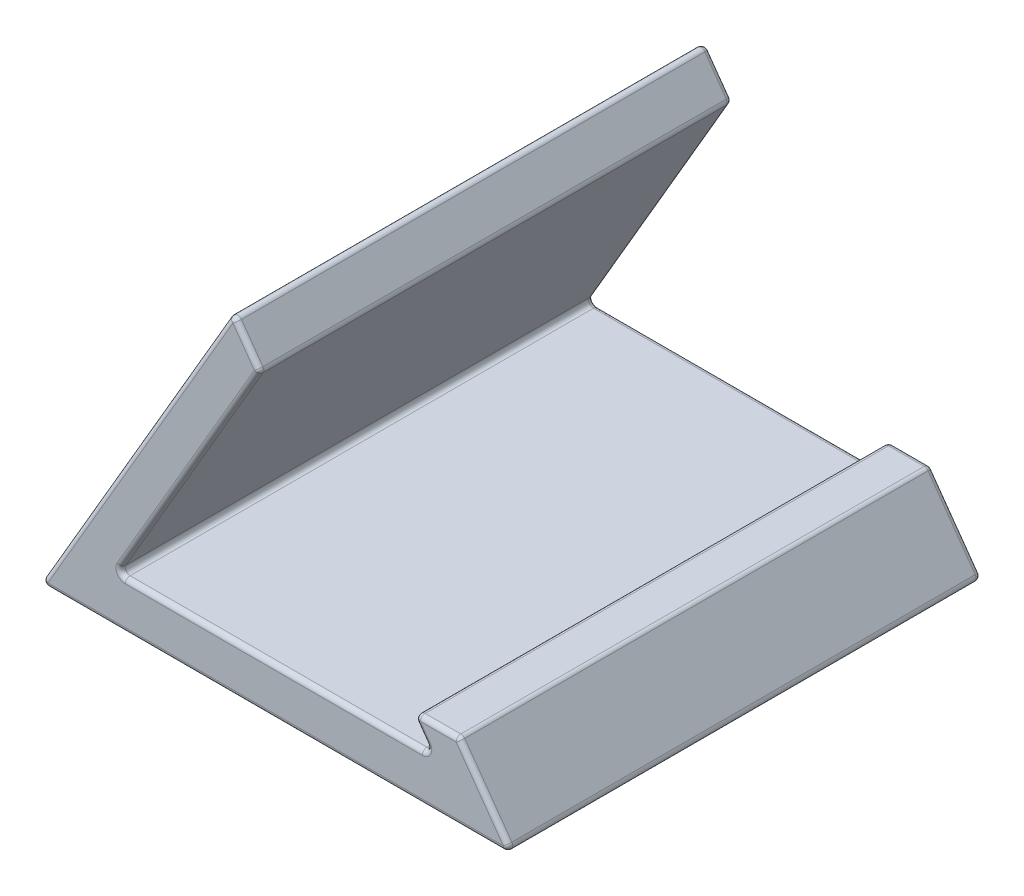
from build123d import *

# Parameters (mm, degrees)
BOSS_EXTRUDE1_DEPTH = 50
FILLET1_R           = 0.5
SKETCH2_W           = 0.897435897
SKETCH2_H           = 5
CUT_EXTRUDE1_DEPTH  = 0.1


with BuildPart() as part:
    # Sketch1 → Boss-Extrude1 (new body)
    with BuildSketch(Plane.XY):
        Polygon((-22.379025494, 0), (27.620974506, 0), (21.919160421, 8), (16.919160421, 8), (19.057340703, 5), (-14.189804496, 5), (0.916580308, 30.919049715), (-1.985406009, 34.990717116), align=None)
    extrude(amount=BOSS_EXTRUDE1_DEPTH)

    # Fillet1
    fillet1_edges = [part.edges().sort_by_distance(p)[0] for p in [
        (2.433768103, 5, 0),
        (17.988250562, 6.5, 0),
        (19.419160421, 8, 0),
        (24.770067463, 4, 0),
        (17.988250562, 6.5, 50),
        (27.620974506, 0, 25),
        (-22.379025494, 0, 25),
        (-1.985406009, 34.990717116, 25),
        (0.916580308, 30.919049715, 25),
        (-14.189804496, 5, 25),
        (19.057340703, 5, 25),
        (16.919160421, 8, 25),
        (21.919160421, 8, 25),
        (2.433768103, 5, 50),
        (-6.636612094, 17.959524858, 50),
        (-0.53441285, 32.954883416, 50),
        (-12.182215751, 17.495358558, 50),
        (2.620974506, 0, 50),
        (24.770067463, 4, 50),
        (2.620974506, 0, 0),
        (19.419160421, 8, 50),
        (-12.182215751, 17.495358558, 0),
        (-0.53441285, 32.954883416, 0),
        (-6.636612094, 17.959524858, 0),
    ]]
    fillet(fillet1_edges, radius=FILLET1_R)

    # Sketch2 → Cut-Extrude1 (cut)
    # profile 1 of 7: a face of its own
    with BuildSketch(Plane(origin=(-16.704628091, 9.73594876, 0), x_dir=(0, 0, 1), z_dir=(-0.8639683238467751, 0.503546160137672, 0))):
        with Locations((10.97078353, 11.529115034)):
            Rectangle(SKETCH2_W, SKETCH2_H)
    # profile 2 of 7: a face of its own
    with BuildSketch(Plane(origin=(-16.704628091, 9.73594876, 0), x_dir=(0, 0, 1), z_dir=(-0.8639683238467751, 0.503546160137672, 0))):
        with BuildLine():
            Line((12.445142504, 12.682961188), (13.342578401, 12.682961188))
            Line((13.342578401, 12.682961188), (13.342578401, 12.296342598))
            add(Edge.make_bspline(
                [(13.342578401, 12.296342598), (13.393776674, 12.33616567), (13.491626527, 12.4122753), (13.640375197, 12.509315467), (13.780775526, 12.588738947), (13.915957185, 12.64915251), (14.048463623, 12.692617471), (14.180440876, 12.723844453), (14.313854353, 12.743839947), (14.403540593, 12.745989727), (14.448347632, 12.747063752)],
                knots=[0, 0, 0, 0, 1.276643801, 2.439914479, 3.493451431, 4.44993799, 5.350072675, 6.235028322, 7.118224225, 8, 8, 8, 8], degree=3))
            add(Edge.make_bspline(
                [(14.448347632, 12.747063752), (14.493798343, 12.745836364), (14.583021906, 12.743426897), (14.714398686, 12.726574632), (14.83991644, 12.69588132), (14.960986513, 12.655128902), (15.076376618, 12.601338047), (15.187500355, 12.537470134), (15.291970823, 12.459674696), (15.356308363, 12.400429425), (15.38885244, 12.370461188)],
                knots=[0, 0, 0, 0, 1.048836932, 2.058954983, 3.049370783, 4.026390553, 5.001981509, 5.982488534, 6.97947532, 8, 8, 8, 8], degree=3))
            add(Edge.make_bspline(
                [(15.38885244, 12.370461188), (15.414953987, 12.342689396), (15.467348114, 12.286942555), (15.533279539, 12.191545433), (15.589856119, 12.087545108), (15.636212764, 11.973741904), (15.670468457, 11.849510545), (15.696821829, 11.716351569), (15.711609166, 11.573519383), (15.713434732, 11.475395019), (15.714373273, 11.424948368)],
                knots=[0, 0, 0, 0, 0.889584746, 1.785680191, 2.700364693, 3.65222533, 4.649950538, 5.707241244, 6.821271309, 8, 8, 8, 8], degree=3))
            Line((15.714373273, 11.424948368), (15.714373273, 9.029115034))
            Line((15.714373273, 9.029115034), (14.816937376, 9.029115034))
            Line((14.816937376, 9.029115034), (14.816937376, 10.615653496))
            add(Edge.make_bspline(
                [(14.816937376, 10.615653496), (14.816747588, 10.667403617), (14.816383895, 10.766573118), (14.813591535, 10.908499578), (14.808139223, 11.036677602), (14.803169583, 11.151340566), (14.793412203, 11.252081339), (14.78461284, 11.339537686), (14.771111071, 11.412916199), (14.753543079, 11.491845799), (14.722865038, 11.576354369), (14.675238876, 11.665398109), (14.61481841, 11.741042752), (14.544071454, 11.803818603), (14.463076141, 11.85348006), (14.372811184, 11.888419988), (14.273760509, 11.910195409), (14.204743162, 11.912522102), (14.168900517, 11.913730419)],
                knots=[0, 0, 0, 0, 1.49886392, 2.872294502, 4.110984203, 5.214877267, 6.195405875, 7.042225351, 7.75923308, 8.355011229, 9.382752534, 10.352059385, 11.267231453, 12.171456522, 13.078624015, 14.003401117, 14.963110155, 16, 16, 16, 16], degree=3))
            add(Edge.make_bspline(
                [(14.168900517, 11.913730419), (14.122285649, 11.911366566), (14.031097905, 11.906742412), (13.899213076, 11.871872065), (13.778079059, 11.81256787), (13.668685616, 11.730502789), (13.572074631, 11.629183278), (13.49250326, 11.508348138), (13.427238389, 11.370913719), (13.399173524, 11.270564269), (13.384645709, 11.218618239)],
                knots=[0, 0, 0, 0, 0.984188326, 1.925263693, 2.85911992, 3.81709677, 4.80007086, 5.801799564, 6.862098548, 8, 8, 8, 8], degree=3))
            add(Edge.make_bspline(
                [(13.384645709, 11.218618239), (13.38103497, 11.202304241), (13.372982295, 11.165920744), (13.366359989, 11.104454802), (13.357147881, 11.031531414), (13.35369633, 10.945830871), (13.347694463, 10.847758758), (13.345474686, 10.737185328), (13.343250937, 10.614327397), (13.342810007, 10.5285158), (13.342578401, 10.483441957)],
                knots=[0, 0, 0, 0, 0.543362196, 1.211806945, 2.009705693, 2.934833164, 4.000995085, 5.207458376, 6.533175157, 8, 8, 8, 8], degree=3))
            Line((13.342578401, 10.483441957), (13.342578401, 9.029115034))
            Line((13.342578401, 9.029115034), (12.445142504, 9.029115034))
            Line((12.445142504, 9.029115034), (12.445142504, 12.682961188))
        make_face()
    # profile 3 of 7: a face of its own
    with BuildSketch(Plane(origin=(-16.704628091, 9.73594876, 0), x_dir=(0, 0, 1), z_dir=(-0.8639683238467751, 0.503546160137672, 0))):
        with BuildLine():
            Line((16.611809171, 12.682961188), (17.509245068, 12.682961188))
            Line((17.509245068, 12.682961188), (17.509245068, 12.296342598))
            add(Edge.make_bspline(
                [(17.509245068, 12.296342598), (17.560443341, 12.33616567), (17.658293194, 12.4122753), (17.807041864, 12.509315467), (17.947442192, 12.588738947), (18.082623852, 12.64915251), (18.21513029, 12.692617471), (18.347107543, 12.723844453), (18.48052102, 12.743839947), (18.57020726, 12.745989727), (18.615014299, 12.747063752)],
                knots=[0, 0, 0, 0, 1.276643801, 2.439914479, 3.493451431, 4.44993799, 5.350072675, 6.235028322, 7.118224225, 8, 8, 8, 8], degree=3))
            add(Edge.make_bspline(
                [(18.615014299, 12.747063752), (18.66046501, 12.745836364), (18.749688573, 12.743426897), (18.881065353, 12.726574632), (19.006583107, 12.69588132), (19.12765318, 12.655128902), (19.243043285, 12.601338047), (19.354167021, 12.537470134), (19.45863749, 12.459674696), (19.52297503, 12.400429425), (19.555519106, 12.370461188)],
                knots=[0, 0, 0, 0, 1.048836932, 2.058954983, 3.049370783, 4.026390553, 5.001981509, 5.982488534, 6.97947532, 8, 8, 8, 8], degree=3))
            add(Edge.make_bspline(
                [(19.555519106, 12.370461188), (19.581620654, 12.342689396), (19.63401478, 12.286942555), (19.699946206, 12.191545433), (19.756522785, 12.087545108), (19.80287943, 11.973741904), (19.837135124, 11.849510545), (19.863488496, 11.716351569), (19.878275833, 11.573519383), (19.880101399, 11.475395019), (19.88103994, 11.424948368)],
                knots=[0, 0, 0, 0, 0.889584746, 1.785680191, 2.700364693, 3.65222533, 4.649950538, 5.707241244, 6.821271309, 8, 8, 8, 8], degree=3))
            Line((19.88103994, 11.424948368), (19.88103994, 9.029115034))
            Line((19.88103994, 9.029115034), (18.983604042, 9.029115034))
            Line((18.983604042, 9.029115034), (18.983604042, 10.615653496))
            add(Edge.make_bspline(
                [(18.983604042, 10.615653496), (18.983414254, 10.667403617), (18.983050561, 10.766573118), (18.980258202, 10.908499578), (18.97480589, 11.036677602), (18.969836249, 11.151340566), (18.96007887, 11.252081339), (18.951279507, 11.339537686), (18.937777738, 11.412916199), (18.920209746, 11.491845799), (18.889531705, 11.576354369), (18.841905542, 11.665398109), (18.781485076, 11.741042752), (18.71073812, 11.803818603), (18.629742808, 11.85348006), (18.53947785, 11.888419988), (18.440427175, 11.910195409), (18.371409829, 11.912522102), (18.335567183, 11.913730419)],
                knots=[0, 0, 0, 0, 1.49886392, 2.872294502, 4.110984203, 5.214877267, 6.195405875, 7.042225351, 7.75923308, 8.355011229, 9.382752534, 10.352059385, 11.267231453, 12.171456522, 13.078624015, 14.003401117, 14.963110155, 16, 16, 16, 16], degree=3))
            add(Edge.make_bspline(
                [(18.335567183, 11.913730419), (18.288952315, 11.911366566), (18.197764572, 11.906742412), (18.065879743, 11.871872065), (17.944745725, 11.81256787), (17.835352283, 11.730502789), (17.738741297, 11.629183278), (17.659169926, 11.508348138), (17.593905056, 11.370913719), (17.565840191, 11.270564269), (17.551312376, 11.218618239)],
                knots=[0, 0, 0, 0, 0.984188326, 1.925263693, 2.85911992, 3.81709677, 4.80007086, 5.801799564, 6.862098548, 8, 8, 8, 8], degree=3))
            add(Edge.make_bspline(
                [(17.551312376, 11.218618239), (17.547701636, 11.202304241), (17.539648962, 11.165920744), (17.533026656, 11.104454802), (17.523814547, 11.031531414), (17.520362997, 10.945830871), (17.51436113, 10.847758758), (17.512141353, 10.737185328), (17.509917604, 10.614327397), (17.509476673, 10.5285158), (17.509245068, 10.483441957)],
                knots=[0, 0, 0, 0, 0.543362196, 1.211806945, 2.009705693, 2.934833164, 4.000995085, 5.207458376, 6.533175157, 8, 8, 8, 8], degree=3))
            Line((17.509245068, 10.483441957), (17.509245068, 9.029115034))
            Line((17.509245068, 9.029115034), (16.611809171, 9.029115034))
            Line((16.611809171, 9.029115034), (16.611809171, 12.682961188))
        make_face()
    # profile 4 of 7: a face of its own
    with BuildSketch(Plane(origin=(-16.704628091, 9.73594876, 0), x_dir=(0, 0, 1), z_dir=(-0.8639683238467751, 0.503546160137672, 0))):
        with BuildLine():
            add(Edge.make_bspline(
                [(22.519261094, 12.747063752), (22.56169013, 12.746308698), (22.645718849, 12.74481335), (22.770869127, 12.732365939), (22.89383149, 12.712057474), (23.015312709, 12.685761558), (23.134184717, 12.648917046), (23.251070984, 12.604727751), (23.367016621, 12.553993273), (23.47914388, 12.493601498), (23.588262798, 12.428101111), (23.691714026, 12.355848809), (23.788638474, 12.27741211), (23.880835388, 12.194609631), (23.964008244, 12.103836421), (24.043472234, 12.009466316), (24.114934111, 11.908118362), (24.181097516, 11.802262176), (24.240002319, 11.692509903), (24.291150308, 11.579625019), (24.335541953, 11.465168237), (24.370299721, 11.347745396), (24.39907595, 11.228904871), (24.417235796, 11.107190361), (24.430146187, 10.983852179), (24.431593851, 10.900810765), (24.432321991, 10.859042919)],
                knots=[0, 0, 0, 0, 1.022364134, 2.024744242, 3.027414945, 4.024939316, 5.017584196, 6.023349371, 7.035562955, 8.064994934, 9.090267829, 10.101425541, 11.102933353, 12.093946398, 13.084502048, 14.067315274, 15.065326281, 16.070028806, 17.074376865, 18.064572984, 19.055292013, 20.030201733, 21.013838017, 21.999348303, 22.993720005, 24, 24, 24, 24], degree=3))
            add(Edge.make_bspline(
                [(24.432321991, 10.859042919), (24.431553559, 10.816948761), (24.430025743, 10.733256033), (24.417702878, 10.608757703), (24.397316679, 10.486470826), (24.370919838, 10.365674989), (24.334213208, 10.247915891), (24.29132543, 10.131457715), (24.238678995, 10.01788783), (24.180474482, 9.905967296), (24.113885674, 9.798989593), (24.042485655, 9.696626377), (23.963354499, 9.601563118), (23.880847465, 9.510851639), (23.791051056, 9.427559396), (23.695398592, 9.350333946), (23.594718157, 9.278231172), (23.488285752, 9.212942742), (23.377464598, 9.155576127), (23.264123674, 9.103855441), (23.147600226, 9.060794278), (23.028135403, 9.025679085), (22.905656756, 8.99849027), (22.780434686, 8.980020585), (22.652738873, 8.967175132), (22.566702463, 8.965737998), (22.523267504, 8.96501247)],
                knots=[0, 0, 0, 0, 1.012026251, 2.012137606, 3.004615893, 3.992048833, 4.982446996, 5.968083444, 6.973977695, 7.990229942, 8.999482246, 10.001782172, 10.988562221, 11.971415814, 12.948383116, 13.930088534, 14.925840678, 15.924049238, 16.929462851, 17.924729459, 18.917889337, 19.913673841, 20.916777188, 21.931792057, 22.95587778, 24, 24, 24, 24], degree=3))
            add(Edge.make_bspline(
                [(22.523267504, 8.96501247), (22.459756737, 8.966876636), (22.334576047, 8.970550936), (22.150214488, 8.995718931), (21.973103888, 9.039039647), (21.802955648, 9.099427771), (21.639548742, 9.176812902), (21.484309253, 9.272588752), (21.335692973, 9.38486977), (21.196274047, 9.512706947), (21.068547424, 9.652955906), (20.956962852, 9.802670815), (20.86221852, 9.9596077), (20.78439967, 10.123945521), (20.724339386, 10.29590963), (20.680965613, 10.474985914), (20.655766849, 10.661677731), (20.652123624, 10.788521537), (20.650270709, 10.853033303)],
                knots=[0, 0, 0, 0, 1.029999031, 2.030143771, 3.011211297, 3.982305373, 4.953580601, 5.938004764, 6.935448627, 7.970290061, 9.001484052, 10.007591832, 10.993831261, 11.969999897, 12.951306496, 13.942897864, 14.953773953, 16, 16, 16, 16], degree=3))
            add(Edge.make_bspline(
                [(20.650270709, 10.853033303), (20.652188241, 10.921917729), (20.655957112, 11.057308687), (20.685883605, 11.255659527), (20.733672985, 11.445571056), (20.80227163, 11.626512031), (20.889900366, 11.798816174), (20.996875194, 11.962120075), (21.123724789, 12.116460726), (21.220866178, 12.209811243), (21.270262696, 12.257280098)],
                knots=[0, 0, 0, 0, 1.043912699, 2.05178951, 3.033892, 4.007821512, 4.978932272, 5.95884105, 6.962068106, 8, 8, 8, 8], degree=3))
            add(Edge.make_bspline(
                [(21.270262696, 12.257280098), (21.31558894, 12.29662644), (21.405008234, 12.374248627), (21.550285159, 12.472699645), (21.699032336, 12.557731289), (21.853032565, 12.627643116), (22.012715159, 12.680355505), (22.177261835, 12.718725408), (22.346638378, 12.742293327), (22.461427773, 12.74546553), (22.519261094, 12.747063752)],
                knots=[0, 0, 0, 0, 1.048115528, 2.067714963, 3.060638214, 4.039924844, 5.017819947, 5.994373833, 6.98952318, 8, 8, 8, 8], degree=3))
        make_face()
        with BuildLine():
            add(Edge.make_bspline(
                [(22.539293145, 11.913730419), (22.50454689, 11.912575568), (22.436148512, 11.910302233), (22.335464304, 11.898101848), (22.240236119, 11.873096112), (22.148572549, 11.84129566), (22.062095131, 11.798767036), (21.978435557, 11.748998744), (21.90194394, 11.686719852), (21.828918606, 11.618404463), (21.762627881, 11.542542057), (21.706141888, 11.459890023), (21.655670402, 11.373610453), (21.617400434, 11.280544546), (21.585728377, 11.183236063), (21.564293108, 11.080112795), (21.549375658, 10.972326685), (21.548268249, 10.89849246), (21.547706606, 10.861046124)],
                knots=[0, 0, 0, 0, 1.030650113, 2.02884584, 2.99876339, 3.944280128, 4.900564847, 5.851248946, 6.823638398, 7.81794922, 8.81432732, 9.802856497, 10.78262424, 11.771747962, 12.779760563, 13.812642396, 14.89064281, 16, 16, 16, 16], degree=3))
            add(Edge.make_bspline(
                [(21.547706606, 10.861046124), (21.548363804, 10.822279242), (21.549648171, 10.746516815), (21.56294806, 10.635893484), (21.584880014, 10.530912676), (21.616038449, 10.431736564), (21.655225441, 10.337653273), (21.703303336, 10.249190676), (21.760779542, 10.166880662), (21.82594361, 10.090824592), (21.897295481, 10.021787655), (21.975477283, 9.962542739), (22.057215056, 9.91106677), (22.144392483, 9.869723622), (22.235771395, 9.837803357), (22.331623057, 9.81430154), (22.432451169, 9.8016399), (22.501200008, 9.799458934), (22.536288337, 9.798345803)],
                knots=[0, 0, 0, 0, 1.141730614, 2.231293227, 3.276944405, 4.297399982, 5.28939179, 6.275415646, 7.257752684, 8.24146775, 9.222424823, 10.176631434, 11.126518621, 12.063689483, 13.012557477, 13.974037417, 14.965980454, 16, 16, 16, 16], degree=3))
            add(Edge.make_bspline(
                [(22.536288337, 9.798345803), (22.571394216, 9.7993331), (22.640222118, 9.801268775), (22.741168635, 9.815763922), (22.837509785, 9.838576426), (22.929669144, 9.870771417), (23.016901594, 9.912999493), (23.099541068, 9.96472173), (23.178314556, 10.02479069), (23.250623977, 10.095130222), (23.317559424, 10.171423485), (23.376257807, 10.254168007), (23.42530839, 10.342630627), (23.465538652, 10.436254738), (23.496758167, 10.534911653), (23.518327034, 10.638968068), (23.53325246, 10.748101505), (23.534334824, 10.822932961), (23.534886094, 10.861046124)],
                knots=[0, 0, 0, 0, 1.031504075, 2.022346795, 2.991027682, 3.937587355, 4.885570121, 5.833146507, 6.798790848, 7.791235734, 8.792807298, 9.778388351, 10.766749885, 11.760164525, 12.768777521, 13.802286646, 14.880660483, 16, 16, 16, 16], degree=3))
            add(Edge.make_bspline(
                [(23.534886094, 10.861046124), (23.534220535, 10.899145966), (23.532914494, 10.973910215), (23.519613658, 11.083191253), (23.497896937, 11.186911329), (23.466336628, 11.284627566), (23.427382558, 11.377454753), (23.379271432, 11.464917741), (23.321511771, 11.546585752), (23.256030922, 11.622053832), (23.183609442, 11.690122024), (23.106785065, 11.750822327), (23.023801053, 11.801026141), (22.936214236, 11.842412005), (22.843791588, 11.87425252), (22.746636868, 11.897887528), (22.644452327, 11.910368998), (22.574712552, 11.912598235), (22.539293145, 11.913730419)],
                knots=[0, 0, 0, 0, 1.123894411, 2.205445421, 3.243160173, 4.246488011, 5.231014757, 6.210004299, 7.185865357, 8.177612767, 9.153374344, 10.115157457, 11.061423229, 12.009021698, 12.96873347, 13.94135618, 14.954456845, 16, 16, 16, 16], degree=3))
        make_face(mode=Mode.SUBTRACT)
    # profile 5 of 7: a face of its own
    with BuildSketch(Plane(origin=(-16.704628091, 9.73594876, 0), x_dir=(0, 0, 1), z_dir=(-0.8639683238467751, 0.503546160137672, 0))):
        with BuildLine():
            Line((29.816937376, 13.161727214), (29.158884491, 12.532720803))
            add(Edge.make_bspline(
                [(29.158884491, 12.532720803), (29.103063084, 12.590440232), (28.994026389, 12.703184358), (28.818327239, 12.852447645), (28.63560652, 12.976838398), (28.4494187, 13.081599499), (28.256414798, 13.160858738), (28.058826466, 13.21861628), (27.855392044, 13.253828871), (27.717715452, 13.257857815), (27.648467824, 13.259884265)],
                knots=[0, 0, 0, 0, 1.115251505, 2.178435587, 3.19620269, 4.182487026, 5.141301733, 6.088180966, 7.038406374, 8, 8, 8, 8], degree=3))
            add(Edge.make_bspline(
                [(27.648467824, 13.259884265), (27.59063764, 13.258283298), (27.476516142, 13.255123967), (27.308955878, 13.231962953), (27.148675825, 13.192576639), (26.995127321, 13.138295004), (26.848762187, 13.068057449), (26.709273551, 12.981918336), (26.577005317, 12.880655624), (26.453704672, 12.764793251), (26.340913574, 12.638204902), (26.241255458, 12.503135435), (26.157775799, 12.359894288), (26.089265402, 12.209932101), (26.03589845, 12.052554775), (25.997787742, 11.887868262), (25.975745526, 11.715676434), (25.972455578, 11.598621713), (25.97078353, 11.53913106)],
                knots=[0, 0, 0, 0, 1.035432265, 2.043311493, 3.022114605, 3.98653278, 4.95457646, 5.923598177, 6.917315552, 7.932509744, 8.948865224, 9.949768934, 10.933144597, 11.912367597, 12.897413939, 13.903909035, 14.934704909, 16, 16, 16, 16], degree=3))
            add(Edge.make_bspline(
                [(25.97078353, 11.53913106), (25.971265395, 11.497376357), (25.972215161, 11.41507698), (25.982612035, 11.293333361), (25.999353452, 11.175213268), (26.023582431, 11.060895623), (26.053881008, 10.950281356), (26.089428137, 10.842416205), (26.134021488, 10.738790623), (26.18352078, 10.638201065), (26.241087886, 10.543392244), (26.303155846, 10.452984165), (26.370458415, 10.367419999), (26.443431516, 10.287049535), (26.523102155, 10.213128783), (26.607411139, 10.143434859), (26.697780646, 10.079712437), (26.79233347, 10.020362334), (26.89188643, 9.968804394), (26.993738423, 9.922102861), (27.09943373, 9.884174273), (27.207685447, 9.85360037), (27.31810672, 9.827601833), (27.431777573, 9.811593734), (27.547712622, 9.799470988), (27.626065255, 9.798722479), (27.665495068, 9.798345803)],
                knots=[0, 0, 0, 0, 1.103660481, 2.175337485, 3.227646561, 4.255952547, 5.262355991, 6.258840057, 7.255597736, 8.242457506, 9.22035537, 10.185017736, 11.140346927, 12.096287581, 13.051739095, 14.01125915, 14.986044842, 15.97314143, 16.960198552, 17.947847494, 18.933482797, 19.925264591, 20.920966487, 21.929612487, 22.958107872, 24, 24, 24, 24], degree=3))
            add(Edge.make_bspline(
                [(27.665495068, 9.798345803), (27.732374806, 9.80028032), (27.863776101, 9.804081143), (28.056626395, 9.833803039), (28.240393513, 9.882693875), (28.38722256, 9.940431113), (28.50225924, 9.997447384), (28.589834965, 10.050184627), (28.680395089, 10.109177024), (28.772435488, 10.176651011), (28.866991432, 10.251796873), (28.962393792, 10.336260446), (29.061084884, 10.427260465), (29.125736441, 10.492208966), (29.158884491, 10.525509265)],
                knots=[0, 0, 0, 0, 1.404581149, 2.759636711, 4.088442092, 5.392261763, 6.066678138, 6.783632037, 7.538459478, 8.336747902, 9.180226004, 10.074962426, 11.012997595, 12, 12, 12, 12], degree=3))
            Line((29.158884491, 10.525509265), (29.796905324, 9.85543715))
            add(Edge.make_bspline(
                [(29.796905324, 9.85543715), (29.752055894, 9.812136433), (29.664519397, 9.727622693), (29.532473022, 9.607621069), (29.400592832, 9.49978627), (29.272064779, 9.400204366), (29.144783438, 9.311776418), (29.018762308, 9.234414113), (28.895428003, 9.166160846), (28.772219446, 9.108167675), (28.648369971, 9.05892545), (28.520943415, 9.016531127), (28.389550224, 8.980667054), (28.253387907, 8.951729457), (28.113726505, 8.928525412), (27.969258971, 8.912862815), (27.820901302, 8.902333372), (27.720267997, 8.901387215), (27.669501478, 8.900909906)],
                knots=[0, 0, 0, 0, 1.244526981, 2.429050516, 3.560637417, 4.644440555, 5.67424972, 6.652764056, 7.595344123, 8.486817594, 9.369275933, 10.254498637, 11.166417451, 12.086725134, 13.032340136, 13.991389299, 14.986715468, 16, 16, 16, 16], degree=3))
            add(Edge.make_bspline(
                [(27.669501478, 8.900909906), (27.576249673, 8.903287081), (27.39378181, 8.90793855), (27.126379915, 8.942402791), (26.872355292, 9.000181485), (26.631089948, 9.081896494), (26.402660599, 9.186283588), (26.187125684, 9.314257264), (25.984832599, 9.465477516), (25.797415471, 9.638171896), (25.62788776, 9.82889834), (25.478044896, 10.033686218), (25.354094873, 10.253541985), (25.251176498, 10.485217672), (25.170695682, 10.729770502), (25.114050832, 10.987465009), (25.079118366, 11.258052372), (25.075296704, 11.442869779), (25.073347632, 11.537127855)],
                knots=[0, 0, 0, 0, 1.078019885, 2.10938526, 3.111377082, 4.085535484, 5.04941344, 6.010039228, 6.978205633, 7.964457913, 8.951525778, 9.924444315, 10.892603023, 11.863865945, 12.85144698, 13.863884204, 14.910567087, 16, 16, 16, 16], degree=3))
            add(Edge.make_bspline(
                [(25.073347632, 11.537127855), (25.074171215, 11.598602168), (25.075803357, 11.720429232), (25.09295731, 11.899890367), (25.116870918, 12.074832873), (25.154807684, 12.243440267), (25.200536713, 12.407984001), (25.257406768, 12.566675678), (25.325327021, 12.719971393), (25.402108242, 12.868127773), (25.488970069, 13.010174234), (25.586004265, 13.144890373), (25.690712792, 13.273316175), (25.805611625, 13.393747832), (25.929031133, 13.507242759), (26.061528542, 13.613185903), (26.202306946, 13.71309661), (26.351747379, 13.804398424), (26.506946612, 13.886985769), (26.665947175, 13.959831333), (26.828358421, 14.020713451), (26.993493661, 14.071212921), (27.162050589, 14.108907205), (27.332826089, 14.137440561), (27.507273255, 14.15339089), (27.624399415, 14.156002061), (27.683523914, 14.157320162)],
                knots=[0, 0, 0, 0, 1.071919942, 2.124283339, 3.142214191, 4.149696895, 5.136002878, 6.119640489, 7.086990633, 8.058538607, 9.028339693, 9.988281803, 10.952401235, 11.916291999, 12.888973767, 13.874849856, 14.873389453, 15.898127285, 16.927174885, 17.938320013, 18.946391617, 19.950418109, 20.947802303, 21.956882652, 22.968648068, 24, 24, 24, 24], degree=3))
            add(Edge.make_bspline(
                [(27.683523914, 14.157320162), (27.733963174, 14.156564594), (27.834317267, 14.155061312), (27.983761351, 14.142529826), (28.132010252, 14.122849253), (28.278533192, 14.09315546), (28.424378254, 14.057905176), (28.567628869, 14.01174979), (28.710544894, 13.960300915), (28.850884904, 13.89880429), (28.988844792, 13.831675169), (29.12119263, 13.755514744), (29.250150528, 13.675009841), (29.372860854, 13.585395829), (29.491622238, 13.489923173), (29.605813666, 13.388146441), (29.714433041, 13.278368715), (29.78259653, 13.200804271), (29.816937376, 13.161727214)],
                knots=[0, 0, 0, 0, 0.996412454, 1.982464992, 2.961075852, 3.949442424, 4.934965278, 5.923860011, 6.921385422, 7.934793307, 8.949617135, 9.951082467, 10.950285876, 11.951772932, 12.951063433, 13.960125323, 14.972308753, 16, 16, 16, 16], degree=3))
        make_face()
    # profile 6 of 7: a face of its own
    with BuildSketch(Plane(origin=(-16.704628091, 9.73594876, 0), x_dir=(0, 0, 1), z_dir=(-0.8639683238467751, 0.503546160137672, 0))):
        Polygon((32.251833209, 14.029115034), (33.086168145, 14.029115034), (35.105398914, 9.029115034), (34.14686526, 9.029115034), (33.758243465, 10.05475606), (31.581761094, 10.05475606), (31.192137696, 9.029115034), (30.233604042, 9.029115034), align=None)
        Polygon((32.669501478, 12.687969201), (31.922305965, 10.952191957), (33.417698594, 10.952191957), align=None, mode=Mode.SUBTRACT)
    # profile 7 of 7: a face of its own
    with BuildSketch(Plane(origin=(-16.704628091, 9.73594876, 0), x_dir=(0, 0, 1), z_dir=(-0.8639683238467751, 0.503546160137672, 0))):
        with BuildLine():
            Line((35.842578401, 14.029115034), (36.973387696, 14.029115034))
            add(Edge.make_bspline(
                [(36.973387696, 14.029115034), (37.061547287, 14.028498769), (37.231960774, 14.02730752), (37.478856202, 14.013885013), (37.708437532, 13.99324215), (37.920852757, 13.964844152), (38.115666391, 13.927265823), (38.292627226, 13.880131175), (38.452329185, 13.825722065), (38.596523367, 13.761698706), (38.728158786, 13.687053829), (38.853150817, 13.603905428), (38.971254042, 13.509207534), (39.084125853, 13.40478706), (39.190309614, 13.288733664), (39.291573666, 13.162969611), (39.385438606, 13.025671149), (39.474741767, 12.880130262), (39.555504594, 12.725730161), (39.625948949, 12.563785069), (39.684960612, 12.395337161), (39.732910644, 12.220206917), (39.771132354, 12.038975715), (39.797875314, 11.851277849), (39.814408078, 11.657287094), (39.816085189, 11.525810035), (39.816937376, 11.459002855)],
                knots=[0, 0, 0, 0, 1.44355588, 2.790409838, 4.047694926, 5.217575253, 6.298404546, 7.294384826, 8.214239204, 9.058592145, 9.873746385, 10.689560431, 11.514393297, 12.350027578, 13.205127629, 14.088021785, 14.991911688, 15.926770944, 16.882954281, 17.842803888, 18.816321264, 19.80318086, 20.814351908, 21.847355356, 22.906180909, 24, 24, 24, 24], degree=3))
            add(Edge.make_bspline(
                [(39.816937376, 11.459002855), (39.81470589, 11.364733576), (39.81031308, 11.179158981), (39.773310504, 10.906830402), (39.713464808, 10.645776297), (39.629316325, 10.398038733), (39.524994732, 10.165823849), (39.400370908, 9.953226658), (39.257272127, 9.761388274), (39.097365499, 9.591263893), (38.924225566, 9.445039683), (38.744298262, 9.319809347), (38.555830767, 9.221054778), (38.389764565, 9.158429613), (38.24576445, 9.119482179), (38.119333907, 9.09646387), (37.975721709, 9.075354693), (37.8135888, 9.059041975), (37.633646419, 9.044495039), (37.435177315, 9.0365908), (37.218824074, 9.030023551), (37.068546291, 9.029425808), (36.99041494, 9.029115034)],
                knots=[0, 0, 0, 0, 1.315458931, 2.589557908, 3.828601765, 5.048913369, 6.235739168, 7.376350998, 8.481830359, 9.569842114, 10.627874879, 11.640079404, 12.624025415, 13.590060155, 14.111227486, 14.704434459, 15.382649715, 16.137166398, 16.978595427, 17.902333227, 18.909396075, 20, 20, 20, 20], degree=3))
            Line((36.99041494, 9.029115034), (35.842578401, 9.029115034))
            Line((35.842578401, 9.029115034), (35.842578401, 14.029115034))
        make_face()
        with BuildLine():
            Line((36.740014299, 13.131679137), (36.740014299, 9.926550932))
            Line((36.740014299, 9.926550932), (37.208764299, 9.926550932))
            add(Edge.make_bspline(
                [(37.208764299, 9.926550932), (37.26453835, 9.926653133), (37.371810417, 9.9268497), (37.526687001, 9.936212348), (37.66990857, 9.945609865), (37.80108087, 9.963446666), (37.921158532, 9.983315608), (38.028492004, 10.010965961), (38.125293893, 10.040010314), (38.210381785, 10.076987376), (38.288315361, 10.11860752), (38.36047295, 10.167370344), (38.430125227, 10.221519621), (38.495969985, 10.282647958), (38.55825643, 10.349945901), (38.616616038, 10.423760207), (38.671827754, 10.503865666), (38.722474398, 10.590685815), (38.768755573, 10.683303814), (38.809812161, 10.780822523), (38.843854131, 10.884054063), (38.872147732, 10.992032062), (38.892366718, 11.105696591), (38.909094073, 11.224205753), (38.917717511, 11.348029071), (38.918901025, 11.432282595), (38.919501478, 11.475028496)],
                knots=[0, 0, 0, 0, 1.50275155, 2.890291501, 4.180787663, 5.369391935, 6.45668281, 7.458360028, 8.354766181, 9.177074746, 9.954075863, 10.732690366, 11.5210699, 12.329727389, 13.151100085, 13.990027547, 14.863562427, 15.770965086, 16.696477834, 17.652329173, 18.619756807, 19.62365428, 20.657822005, 21.729286259, 22.847956731, 24, 24, 24, 24], degree=3))
            add(Edge.make_bspline(
                [(38.919501478, 11.475028496), (38.918305578, 11.540532548), (38.915973666, 11.668260375), (38.89348521, 11.854298743), (38.856878294, 12.029481736), (38.804643752, 12.193159204), (38.738800492, 12.345791165), (38.656382304, 12.486084504), (38.560936149, 12.616395956), (38.485459934, 12.692840835), (38.447746671, 12.731038111)],
                knots=[0, 0, 0, 0, 1.13821349, 2.219428113, 3.251817212, 4.244760574, 5.201143372, 6.134805572, 7.068016741, 8, 8, 8, 8], degree=3))
            add(Edge.make_bspline(
                [(38.447746671, 12.731038111), (38.410557822, 12.763587355), (38.334603809, 12.830065498), (38.201253522, 12.909723316), (38.054308413, 12.979710516), (37.890406817, 13.035202561), (37.711132771, 13.079088035), (37.515418515, 13.109354774), (37.304312141, 13.128803859), (37.158062564, 13.130700177), (37.082562376, 13.131679137)],
                knots=[0, 0, 0, 0, 0.813307809, 1.661089106, 2.549956539, 3.493439533, 4.508053171, 5.589449661, 6.755572447, 8, 8, 8, 8], degree=3))
            Line((37.082562376, 13.131679137), (36.740014299, 13.131679137))
        make_face(mode=Mode.SUBTRACT)
    extrude(amount=-CUT_EXTRUDE1_DEPTH, mode=Mode.SUBTRACT)


solid = part.part
